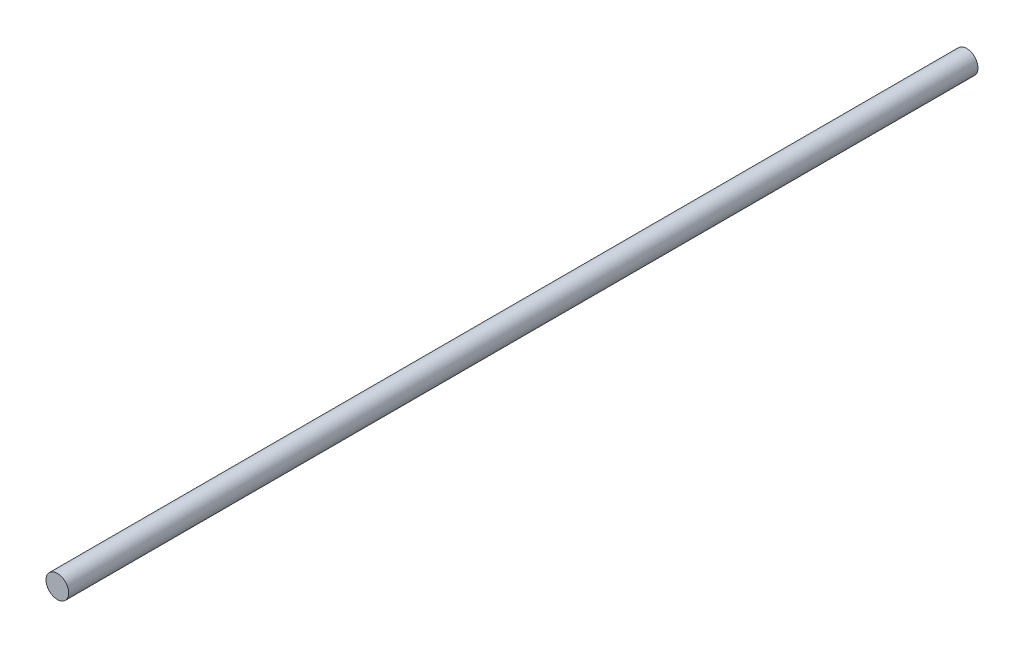
from build123d import *

# Parameters (mm, degrees)
BOSS_EXTRUDE1_DEPTH      = 15
BOSS_EXTRUDE1_DEPTH_BACK = 145
SKETCH1_R                = 2


with BuildPart() as part:
    # Sketch1 → Boss-Extrude1 (new, two sides: drawn at the far end of the back side and taken through both)
    with BuildSketch(Plane.XY.offset(-BOSS_EXTRUDE1_DEPTH_BACK)):
        with Locations((35, -7.5)):
            Circle(SKETCH1_R)
    extrude(amount=BOSS_EXTRUDE1_DEPTH + BOSS_EXTRUDE1_DEPTH_BACK)


solid = part.part
